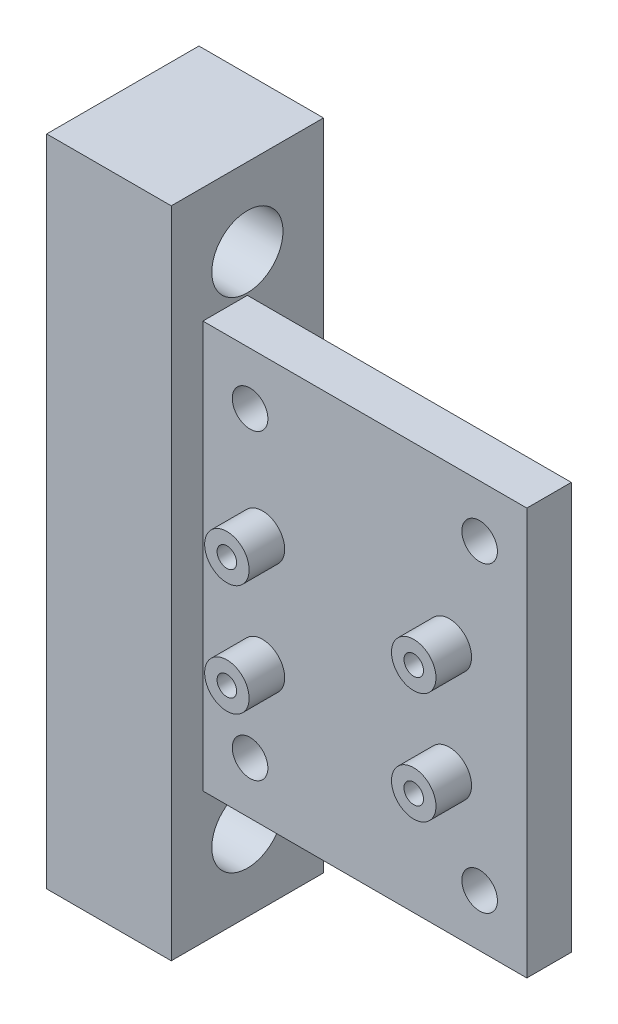
from build123d import *

# Parameters (mm, degrees)
IZIM1_W                     = 36.405816339
IZIM1_H                     = 45.737890708
IZIM1_R                     = 2
IZIM1_R_2                   = 2.5
IZIM1_R_3                   = 1.1
Y_KSEKLIK_EKSTR_ZYON3_DEPTH = 5
IZIM2_R                     = 2.5
Y_KSEKLIK_EKSTR_ZYON4_DEPTH = 4
IZIM3_R                     = 1.1
KES_EKSTR_ZYON1_DEPTH       = 17
IZIM5_W                     = 17.110844688
IZIM5_H                     = 73.483837376
Y_KSEKLIK_EKSTR_ZYON6_DEPTH = 14
IZIM6_R                     = 4
KES_EKSTR_ZYON2_DEPTH       = 31


with BuildPart() as part:
    # Çizim1 → Yükseklik-Ekstrüzyon3 (new body)
    # profile 1 of 5: a face of its own
    with BuildSketch(Plane.XY):
        with Locations((0.30959843, 0.881738623)):
            Rectangle(IZIM1_W, IZIM1_H)
        with Locations((-12.59040157, -16.118261377)):
            Circle(IZIM1_R, mode=Mode.SUBTRACT)
        with Locations((13.20959843, -16.118261377)):
            Circle(IZIM1_R, mode=Mode.SUBTRACT)
        with Locations((13.20959843, 17.881738623)):
            Circle(IZIM1_R, mode=Mode.SUBTRACT)
        with Locations((-12.59040157, 17.881738623)):
            Circle(IZIM1_R, mode=Mode.SUBTRACT)
        with Locations((-11.198102854, -6.37596266)):
            Circle(IZIM1_R_2, mode=Mode.SUBTRACT)
        with Locations((9.801897146, -6.37596266)):
            Circle(IZIM1_R_2, mode=Mode.SUBTRACT)
        with Locations((9.801897146, 6.12403734)):
            Circle(IZIM1_R_2, mode=Mode.SUBTRACT)
        with Locations((-11.198102854, 6.12403734)):
            Circle(IZIM1_R_2, mode=Mode.SUBTRACT)
    # profile 2 of 5: a face of its own
    with BuildSketch(Plane.XY):
        with Locations((9.801897146, -6.37596266)):
            Circle(IZIM1_R_2)
        with Locations((9.801897146, -6.37596266)):
            Circle(IZIM1_R_3, mode=Mode.SUBTRACT)
    # profile 3 of 5: a face of its own
    with BuildSketch(Plane.XY):
        with Locations((9.801897146, 6.12403734)):
            Circle(IZIM1_R_2)
        with Locations((9.801897146, 6.12403734)):
            Circle(IZIM1_R_3, mode=Mode.SUBTRACT)
    # profile 4 of 5: a face of its own
    with BuildSketch(Plane.XY):
        with Locations((-11.198102854, 6.12403734)):
            Circle(IZIM1_R_2)
        with Locations((-11.198102854, 6.12403734)):
            Circle(IZIM1_R_3, mode=Mode.SUBTRACT)
    # profile 5 of 5: a face of its own
    with BuildSketch(Plane.XY):
        with Locations((-11.198102854, -6.37596266)):
            Circle(IZIM1_R_2)
        with Locations((-11.198102854, -6.37596266)):
            Circle(IZIM1_R_3, mode=Mode.SUBTRACT)
    extrude(amount=Y_KSEKLIK_EKSTR_ZYON3_DEPTH)

    # Çizim2 → Yükseklik-Ekstrüzyon4 (add)
    with BuildSketch(Plane.XY.offset(5)):
        with Locations((-11.198102854, 6.12403734)):
            Circle(IZIM2_R)
        with Locations((-11.198102854, -6.37596266)):
            Circle(IZIM2_R)
        with Locations((9.801897146, -6.37596266)):
            Circle(IZIM2_R)
        with Locations((9.801897146, 6.12403734)):
            Circle(IZIM2_R)
    extrude(amount=Y_KSEKLIK_EKSTR_ZYON4_DEPTH)

    # Çizim3 → Kes-Ekstrüzyon1 (cut, symmetric)
    with BuildSketch(Plane(origin=(0, 0, 5), x_dir=(-1, 0, 0), z_dir=(0, 0, -1))):
        with Locations(Location((11.198102854, 6.12403734, 0), (0, 0, 180))):
            Circle(IZIM3_R)
        with Locations(Location((11.198102854, -6.37596266, 0), (0, 0, 180))):
            Circle(IZIM3_R)
        with Locations(Location((-9.801897146, -6.37596266, 0), (0, 0, 180))):
            Circle(IZIM3_R)
        with Locations(Location((-9.801897146, 6.12403734, 0), (0, 0, 180))):
            Circle(IZIM3_R)
    extrude(amount=KES_EKSTR_ZYON1_DEPTH, both=True, mode=Mode.SUBTRACT)

    # Çizim5 → Yükseklik-Ekstrüzyon6 (add)
    with BuildSketch(Plane.ZY.offset(17.89330974)):
        Rectangle(IZIM5_W, IZIM5_H)
    extrude(amount=Y_KSEKLIK_EKSTR_ZYON6_DEPTH)

    # Çizim6 → Kes-Ekstrüzyon2 (cut, symmetric)
    with BuildSketch(Plane(origin=(-17.89330974, 0, 0), x_dir=(0, 0, -1), z_dir=(1, 0, 0))):
        with Locations((0, 28)):
            Circle(IZIM6_R)
        with Locations((0, -28)):
            Circle(IZIM6_R)
    extrude(amount=KES_EKSTR_ZYON2_DEPTH, both=True, mode=Mode.SUBTRACT)


solid = part.part
